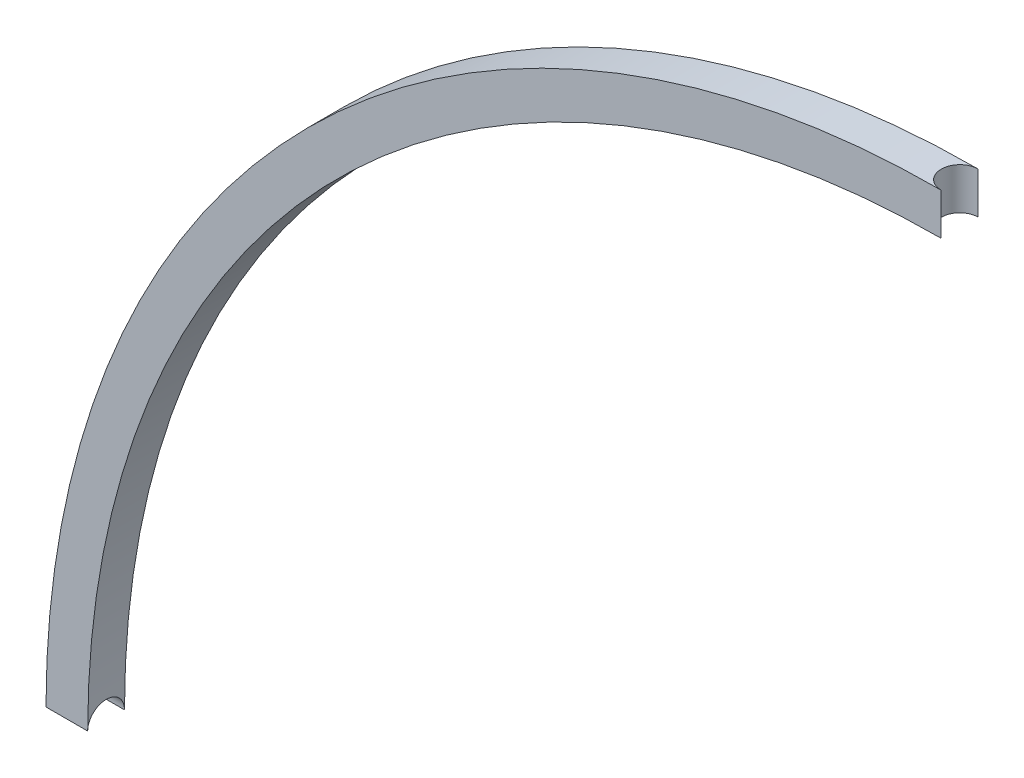
from build123d import *

# Parameters (mm, degrees)
BOSS_EXTRUDE1_DEPTH = 6
SKETCH3_R           = 3
CUT_EXTRUDE1_DEPTH  = 172
SKETCH4_R           = 3
CUT_EXTRUDE2_DEPTH  = 175


with BuildPart() as part:
    # Sketch2 → Boss-Extrude1 (new body)
    with BuildSketch(Plane.XY):
        with BuildLine():
            Line((0, 139.2), (0, 146))
            ThreePointArc((0, 146), (-103.237590053, 103.237590053), (-146, 0))
            Line((-146, 0), (-139.2, 0))
            ThreePointArc((-139.2, 0), (-98.429263941, 98.429263941), (0, 139.2))
        make_face()
    extrude(amount=BOSS_EXTRUDE1_DEPTH)

    # Sketch3 → Cut-Extrude1 (cut)
    with BuildSketch(Plane(origin=(0, 0, 0), x_dir=(0, 0, -1), z_dir=(1, 0, 0))):
        with Locations((-3, 0)):
            Circle(SKETCH3_R)
    extrude(amount=-CUT_EXTRUDE1_DEPTH, mode=Mode.SUBTRACT)

    # Sketch4 → Cut-Extrude2 (cut)
    with BuildSketch(Plane(origin=(0, 0, 0), x_dir=(1, 0, 0), z_dir=(0, 1, 0))):
        with Locations((0, -3)):
            Circle(SKETCH4_R)
    extrude(amount=CUT_EXTRUDE2_DEPTH, mode=Mode.SUBTRACT)


solid = part.part
